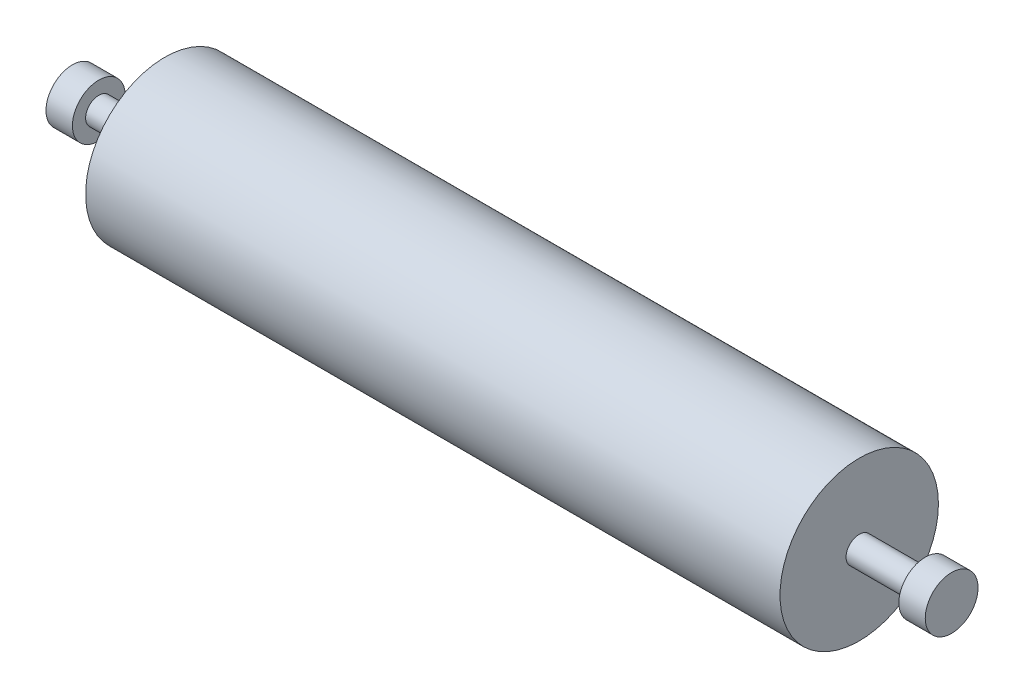
from build123d import *

# Parameters (mm, degrees)
BOSS_EXTRUDE1_DEPTH      = 167.005
BOSS_EXTRUDE1_DEPTH_BACK = 167.005
SKETCH1_R                = 38.1
SKETCH2_R                = 6.35
BOSS_EXTRUDE2_DEPTH      = 31.75
SKETCH3_R                = 12.7
BOSS_EXTRUDE3_DEPTH      = 12.7


with BuildPart() as part:
    # Sketch1 → Boss-Extrude1 (new, two sides: drawn at the far end of the back side and taken through both)
    with BuildSketch(Plane(origin=(0, 0, 0), x_dir=(0, 0, -1), z_dir=(1, 0, 0)).offset(-BOSS_EXTRUDE1_DEPTH_BACK)):
        Circle(SKETCH1_R)
    extrude(amount=BOSS_EXTRUDE1_DEPTH + BOSS_EXTRUDE1_DEPTH_BACK)

    # Sketch2 → Boss-Extrude2 (add)
    with BuildSketch(Plane.ZY.offset(167.005)):
        Circle(SKETCH2_R)
    boss_extrude2 = extrude(amount=BOSS_EXTRUDE2_DEPTH)

    # Sketch3 → Boss-Extrude3 (add)
    with BuildSketch(Plane.ZY.offset(198.755)):
        Circle(SKETCH3_R)
    boss_extrude3 = extrude(amount=BOSS_EXTRUDE3_DEPTH)

    # Mirror1: Boss-Extrude2, Boss-Extrude3 across plane
    add(boss_extrude2.mirror(Plane(origin=(0, 0, 0), x_dir=(0, 0, 1), z_dir=(1, 0, 0))))
    add(boss_extrude3.mirror(Plane(origin=(0, 0, 0), x_dir=(0, 0, 1), z_dir=(1, 0, 0))))


solid = part.part
